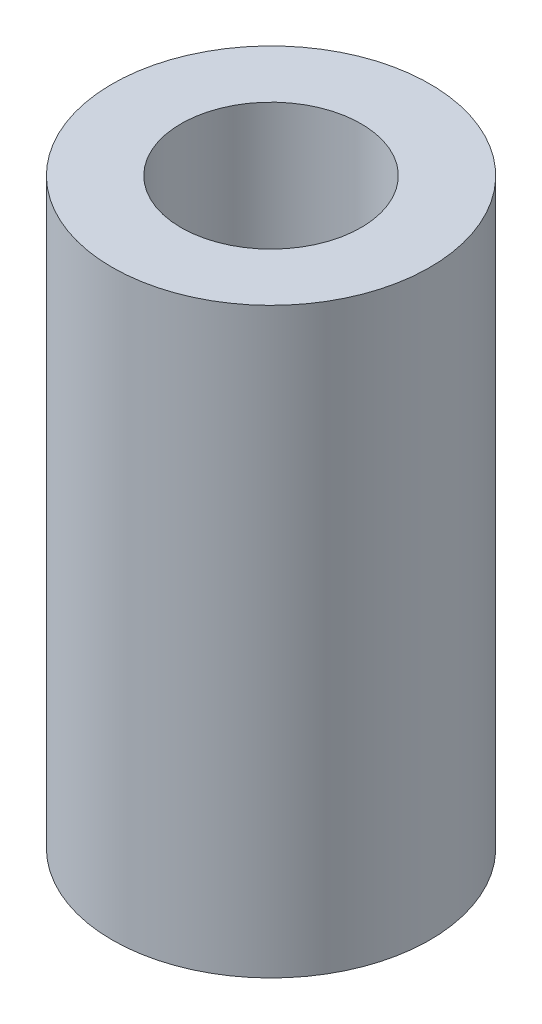
from build123d import *

# Parameters (mm, degrees)
SKETCH2_R            = 3
BOSS_EXTRUDE1_DEPTH  = 5.5
M3_CLEARANCE_HOLE1_D = 3.4


with BuildPart() as part:
    # Sketch2 → Boss-Extrude1 (new, symmetric)
    with BuildSketch(Plane(origin=(0, 0, 0), x_dir=(1, 0, 0), z_dir=(0, 1, 0))):
        with Locations(Location((0, 0, 0), (0, 0, 270))):
            Circle(SKETCH2_R)
    extrude(amount=BOSS_EXTRUDE1_DEPTH, both=True)

    # M3 Clearance Hole1 (through all)
    with Locations(Plane(origin=(0, 5.5, 0), x_dir=(1, 0, 0), z_dir=(0, 1, 0))):
        with Locations((0, 0)):
            Hole(M3_CLEARANCE_HOLE1_D / 2)


solid = part.part
